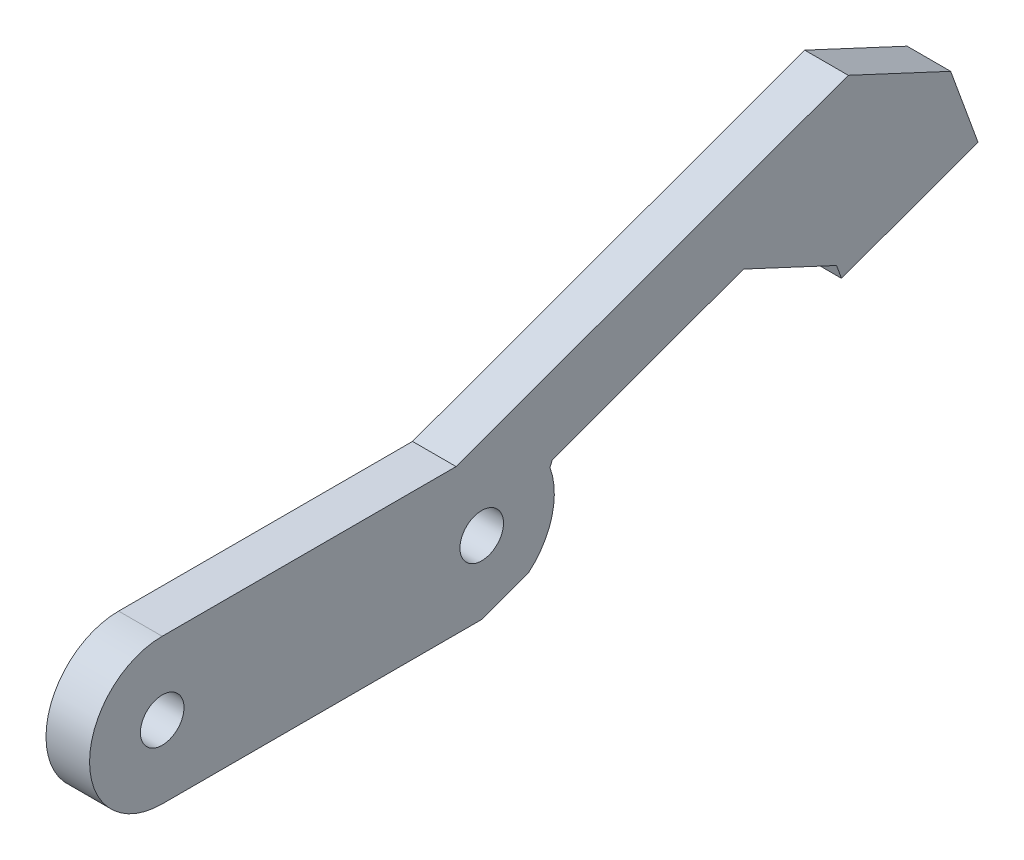
from build123d import *

# Parameters (mm, degrees)
SKETCH1_R           = 5
SKETCH1_R_2         = 1.5
BOSS_EXTRUDE1_DEPTH = 3
BOSS_EXTRUDE2_START = -3
BOSS_EXTRUDE2_DEPTH = 3
CUT_EXTRUDE1_START  = -3
CUT_EXTRUDE1_DEPTH  = 3
CUT_EXTRUDE2_DEPTH  = 65.978416693


with BuildPart() as part:
    # Sketch1 → Boss-Extrude1 (new body)
    # profile 1 of 3: a face of its own
    with BuildSketch(Plane(origin=(0, 0, 0), x_dir=(0, 0, -1), z_dir=(1, 0, 0))):
        with Locations((5, 5)):
            Circle(SKETCH1_R)
        with Locations((5, 5)):
            Circle(SKETCH1_R_2, mode=Mode.SUBTRACT)
    # profile 2 of 3: a face of its own
    with BuildSketch(Plane(origin=(0, 0, 0), x_dir=(0, 0, -1), z_dir=(1, 0, 0))):
        with BuildLine():
            ThreePointArc((10, 5), (8.535533906, 1.464466094), (5, 0))
            Line((5, 0), (27, 0))
            ThreePointArc((27, 0), (22, 5), (27, 10))
            Line((27, 10), (5, 10))
            ThreePointArc((5, 10), (8.535533906, 8.535533906), (10, 5))
        make_face()
    # profile 3 of 3: a face of its own
    with BuildSketch(Plane(origin=(0, 0, 0), x_dir=(0, 0, -1), z_dir=(1, 0, 0))):
        with Locations((27, 5)):
            Circle(SKETCH1_R)
        with Locations((27, 5)):
            Circle(SKETCH1_R_2, mode=Mode.SUBTRACT)
    extrude(amount=BOSS_EXTRUDE1_DEPTH)

    # Sketch2 → Boss-Extrude2 (add)
    with BuildSketch(Plane(origin=(3, 0, 0), x_dir=(0, 0, -1), z_dir=(1, 0, 0)).offset(BOSS_EXTRUDE2_START)):
        with BuildLine():
            ThreePointArc((27, 10), (29.863119288, 9.099091112), (31.69447473, 6.721019177))
            Line((31.69447473, 6.721019177), (31.867747629, 7.092604107))
            Line((31.867747629, 7.092604107), (45.02344432, 11.880886114))
            Line((45.02344432, 11.880886114), (51.43200814, 8.892523726))
            Line((51.43200814, 8.892523726), (60.828934348, 12.31272516))
            Line((60.828934348, 12.31272516), (57.408732915, 21.709651368))
            Line((57.408732915, 21.709651368), (25.236730193, 10))
            Line((25.236730193, 10), (27, 10))
        make_face()
        Polygon((60.828934348, 12.31272516), (51.43200814, 8.892523726), (51.774028284, 7.952831106), (61.170954492, 11.373032539), align=None)
    extrude(amount=BOSS_EXTRUDE2_DEPTH)

    # Sketch3 → Cut-Extrude1 (cut)
    with BuildSketch(Plane(origin=(3, 0, 0), x_dir=(0, 0, -1), z_dir=(1, 0, 0)).offset(CUT_EXTRUDE1_START)):
        with BuildLine():
            ThreePointArc((27, 0), (28.710100717, 0.301536896), (30.213938048, 1.169777784))
            Line((30.213938048, 1.169777784), (27, 0))
        make_face()
    extrude(amount=CUT_EXTRUDE1_DEPTH, mode=Mode.SUBTRACT)

    # Sketch4 → Cut-Extrude2 (cut, through all)
    with BuildSketch(Plane(origin=(3, 0, 0), x_dir=(0, 0, -1), z_dir=(1, 0, 0))):
        Polygon((57.408732915, 21.709651368), (52.240423501, 19.828540579), (59.289843703, 16.541341953), align=None)
    extrude(amount=-CUT_EXTRUDE2_DEPTH, mode=Mode.SUBTRACT)


solid = part.part
